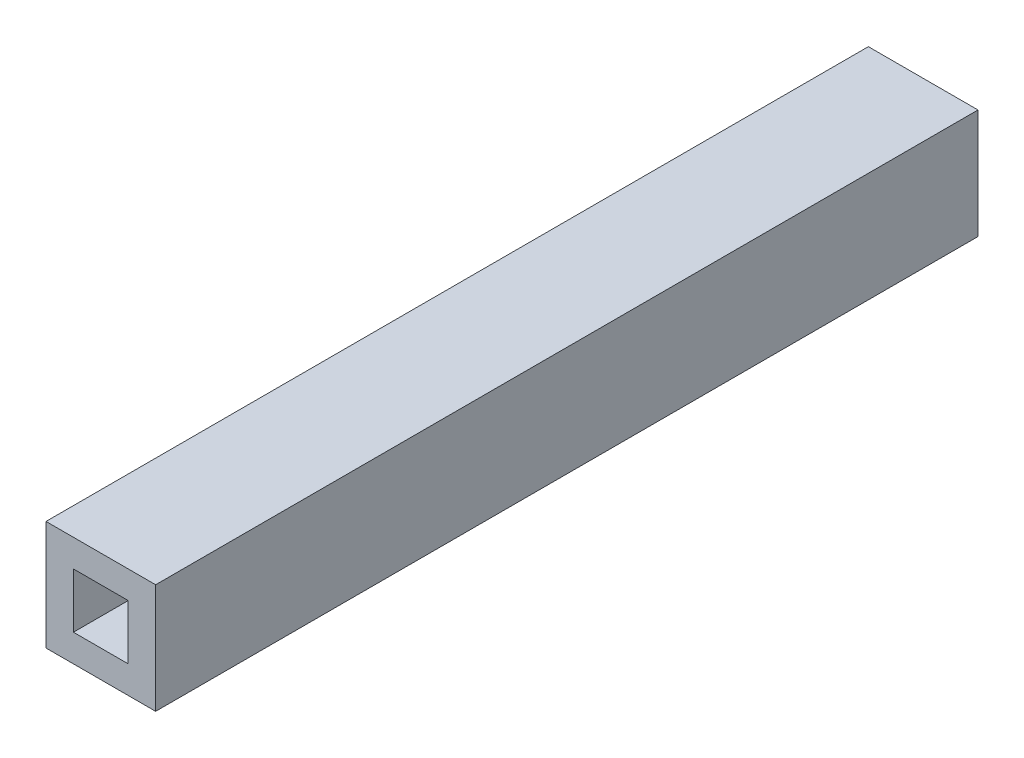
from build123d import *

# Parameters (mm, degrees)
SKETCH1_W           = 20
SKETCH1_H           = 20
SKETCH1_W_2         = 10
SKETCH1_H_2         = 10
EXTRUDE_THIN1_DEPTH = 150


with BuildPart() as part:
    # Sketch1 → Extrude-Thin1 (new body)
    with BuildSketch(Plane.XY):
        Rectangle(SKETCH1_W, SKETCH1_H)
        Rectangle(SKETCH1_W_2, SKETCH1_H_2, mode=Mode.SUBTRACT)
    extrude(amount=EXTRUDE_THIN1_DEPTH)


solid = part.part
